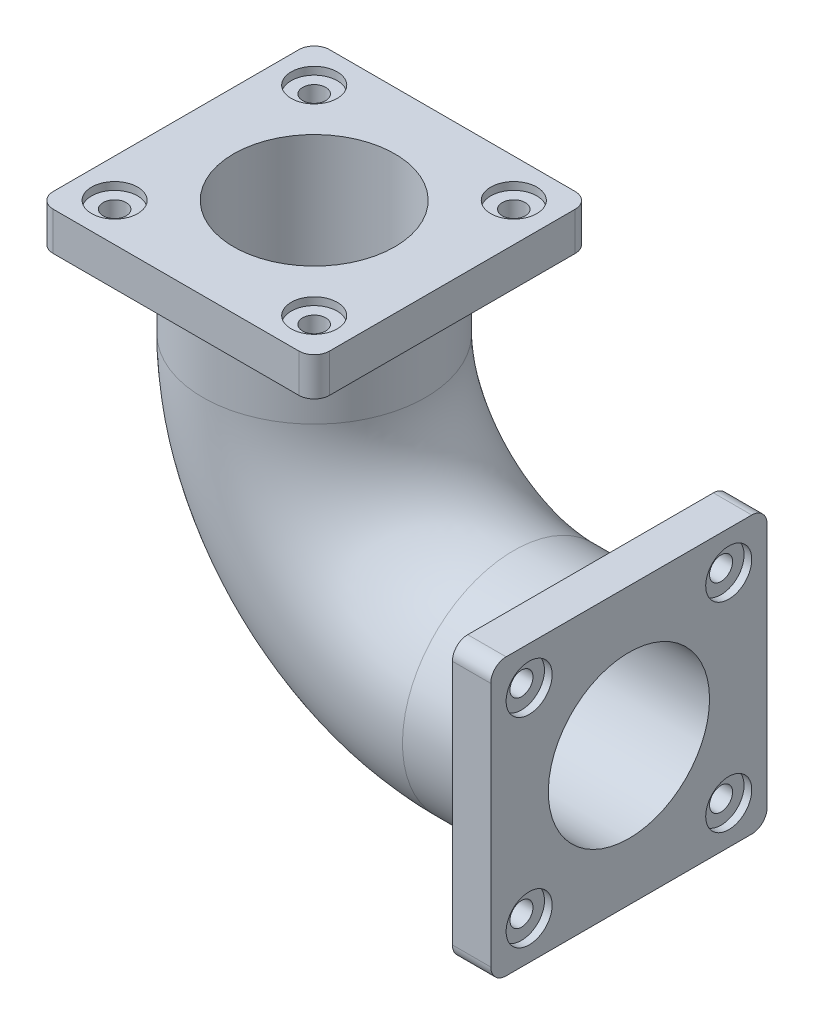
from build123d import *

# Parameters (mm, degrees)
SKETCH2_R           = 14.5
SKETCH2_R_2         = 10.5
BOSS_EXTRUDE2_START = -5
SKETCH9_W           = 36
SKETCH9_H           = 36
SKETCH9_R           = 14.5
BOSS_EXTRUDE2_DEPTH = 5
FILLET1_R           = 2
FILLET2_R           = 2
SKETCH10_R          = 3
CUT_EXTRUDE1_DEPTH  = 1
CUT_EXTRUDE2_REACH  = 72.535
SKETCH13_R          = 1.5
CIRPATTERN1_COUNT   = 4
SKETCH15_W          = 36
SKETCH15_H          = 36
SKETCH15_R          = 14.5
BOSS_EXTRUDE6_DEPTH = 5
FILLET3_R           = 2
SKETCH16_R          = 3
CUT_EXTRUDE4_DEPTH  = 1
CUT_EXTRUDE5_REACH  = 86.67
SKETCH17_R          = 1.5
CIRPATTERN2_COUNT   = 4


with BuildPart() as part:
    # Sweep-Thin3: sweep along a path in Sketch1
    with BuildLine(Plane.XY) as sweep_thin3_path:
        Line((0, 0), (-15, 0))
        ThreePointArc((-15, 0), (-33.384776311, 7.615223689), (-41, 26))
        Line((-41, 26), (-41, 41))
    # Sketch2 → Sweep-Thin3 (sweep)
    with BuildSketch(Plane(origin=(0, 0, 0), x_dir=(0, 0, -1), z_dir=(1, 0, 0))):
        Circle(SKETCH2_R)
        Circle(SKETCH2_R_2, mode=Mode.SUBTRACT)
    sweep(path=sweep_thin3_path.line)

    # Sketch9 → Boss-Extrude2 (add)
    with BuildSketch(Plane(origin=(0, 0, 0), x_dir=(0, 0, -1), z_dir=(1, 0, 0)).offset(BOSS_EXTRUDE2_START)):
        Rectangle(SKETCH9_W, SKETCH9_H)
        with Locations(Location((0, 0, 0), (0, 0, 270))):
            Circle(SKETCH9_R, mode=Mode.SUBTRACT)
    extrude(amount=BOSS_EXTRUDE2_DEPTH)

    # Fillet1
    fillet1_edges = [part.edges().sort_by_distance(p)[0] for p in [
        (-2.5, 18, 18),
    ]]
    fillet(fillet1_edges, radius=FILLET1_R)

    # Fillet2
    fillet2_edges = [part.edges().sort_by_distance(p)[0] for p in [
        (-2.5, 18, -18),
        (-2.5, -18, -18),
        (-2.5, -18, 18),
    ]]
    fillet(fillet2_edges, radius=FILLET2_R)

    # Sketch10 → Cut-Extrude1 (cut)
    with BuildSketch(Plane(origin=(0, 0, 0), x_dir=(0, 0, -1), z_dir=(1, 0, 0))):
        with Locations((-13, 13)):
            Circle(SKETCH10_R)
    cut_extrude1 = extrude(amount=-CUT_EXTRUDE1_DEPTH, mode=Mode.SUBTRACT)

    # Sketch13 → Cut-Extrude2 (cut, up to next)
    with BuildSketch(Plane(origin=(-1, 0, 0), x_dir=(0, 0, -1), z_dir=(1, 0, 0)), mode=Mode.PRIVATE) as cut_extrude2_sk1:
        with Locations((-13, 13)):
            Circle(SKETCH13_R)
    cut_extrude2_tool1 = extrude(cut_extrude2_sk1.sketch, amount=-CUT_EXTRUDE2_REACH, mode=Mode.PRIVATE) & part.part
    cut_extrude2 = cut_extrude2_tool1.solids().sort_by_distance((-1, 13, 13))[0]
    add(cut_extrude2, mode=Mode.SUBTRACT)

    # CirPattern1: Cut-Extrude1, Cut-Extrude2 ×4 about axis
    cirpattern1_axis = Axis((0, 0, 0), (1, 0, 0))
    add([cut_extrude1.rotate(cirpattern1_axis, i * 360 / CIRPATTERN1_COUNT) for i in range(1, CIRPATTERN1_COUNT)], mode=Mode.SUBTRACT)
    add([cut_extrude2.rotate(cirpattern1_axis, i * 360 / CIRPATTERN1_COUNT) for i in range(1, CIRPATTERN1_COUNT)], mode=Mode.SUBTRACT)

    # Sketch15 → Boss-Extrude6 (add)
    with BuildSketch(Plane(origin=(0, 41, 0), x_dir=(1, 0, 0), z_dir=(0, 1, 0))):
        with Locations((-41, 0)):
            Rectangle(SKETCH15_W, SKETCH15_H)
        with Locations(Location((-41, 0, 0), (0, 0, 180))):
            Circle(SKETCH15_R, mode=Mode.SUBTRACT)
    extrude(amount=-BOSS_EXTRUDE6_DEPTH)

    # Fillet3
    fillet3_edges = [part.edges().sort_by_distance(p)[0] for p in [
        (-23, 38.5, -18),
        (-23, 38.5, 18),
        (-59, 38.5, 18),
        (-59, 38.5, -18),
    ]]
    fillet(fillet3_edges, radius=FILLET3_R)

    # Sketch16 → Cut-Extrude4 (cut)
    with BuildSketch(Plane(origin=(0, 41, 0), x_dir=(1, 0, 0), z_dir=(0, 1, 0))):
        with Locations(Location((-54, 13, 0), (0, 0, 180))):
            Circle(SKETCH16_R)
    cut_extrude4 = extrude(amount=-CUT_EXTRUDE4_DEPTH, mode=Mode.SUBTRACT)

    # Sketch17 → Cut-Extrude5 (cut, up to next)
    with BuildSketch(Plane(origin=(0, 40, 0), x_dir=(1, 0, 0), z_dir=(0, 1, 0)), mode=Mode.PRIVATE) as cut_extrude5_sk1:
        with Locations(Location((-54, 13, 0), (0, 0, 180))):
            Circle(SKETCH17_R)
    cut_extrude5_tool1 = extrude(cut_extrude5_sk1.sketch, amount=-CUT_EXTRUDE5_REACH, mode=Mode.PRIVATE) & part.part
    cut_extrude5 = cut_extrude5_tool1.solids().sort_by_distance((-54, 40, -13))[0]
    add(cut_extrude5, mode=Mode.SUBTRACT)

    # CirPattern2: Cut-Extrude4, Cut-Extrude5 ×4 about axis
    cirpattern2_axis = Axis((-41, 0, 0), (0, 1, 0))
    add([cut_extrude4.rotate(cirpattern2_axis, i * 360 / CIRPATTERN2_COUNT) for i in range(1, CIRPATTERN2_COUNT)], mode=Mode.SUBTRACT)
    add([cut_extrude5.rotate(cirpattern2_axis, i * 360 / CIRPATTERN2_COUNT) for i in range(1, CIRPATTERN2_COUNT)], mode=Mode.SUBTRACT)


solid = part.part
